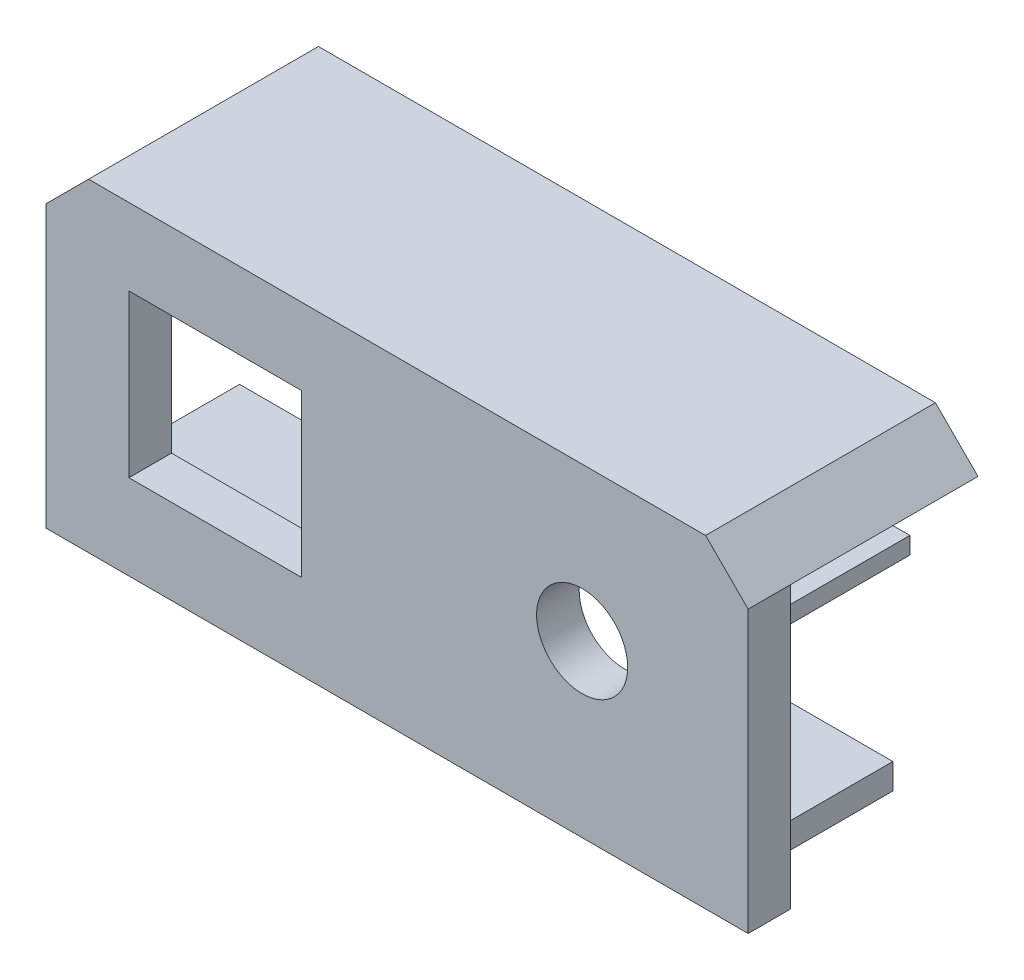
from build123d import *

# Parameters (mm, degrees)
SKETCH1_W           = 82.48
SKETCH1_H           = 33
BOSS_EXTRUDE1_DEPTH = 5
SKETCH2_W           = 82.48
SKETCH2_H           = 5
BOSS_EXTRUDE2_DEPTH = 5
CHAMFER1_SIZE       = 5
CUT_EXTRUDE1_REACH  = 92.95
SKETCH3_R           = 5.35
BOSS_EXTRUDE3_DEPTH = 22
SKETCH5_W           = 21.796115959
SKETCH5_H           = 3
SKETCH5_W_2         = 39.443884041
BOSS_EXTRUDE4_DEPTH = 15
SKETCH6_W           = 4
SKETCH6_H           = 23
BOSS_EXTRUDE5_DEPTH = 3
CUT_EXTRUDE2_REACH  = 95.44
SKETCH7_W           = 20.272158998
SKETCH7_H           = 19


with BuildPart() as part:
    # Sketch1 → Boss-Extrude1 (new body)
    with BuildSketch(Plane.XY):
        with Locations((41.24, 16.5)):
            Rectangle(SKETCH1_W, SKETCH1_H)
    extrude(amount=BOSS_EXTRUDE1_DEPTH)

    # Sketch2 → Boss-Extrude2 (add)
    with BuildSketch(Plane(origin=(0, 33, 0), x_dir=(1, 0, 0), z_dir=(0, 1, 0))):
        with Locations((41.24, -2.5)):
            Rectangle(SKETCH2_W, SKETCH2_H)
    extrude(amount=BOSS_EXTRUDE2_DEPTH)

    # Chamfer1
    chamfer1_edges = [part.edges().sort_by_distance(p)[0] for p in [
        (82.48, 38, 2.5),
        (0, 38, 2.5),
    ]]
    chamfer(chamfer1_edges, length=CHAMFER1_SIZE)

    # Sketch3 → Cut-Extrude1 (cut, up to next)
    with BuildSketch(Plane.XY.offset(5), mode=Mode.PRIVATE) as cut_extrude1_sk1:
        with Locations((62.98, 20)):
            Circle(SKETCH3_R)
    cut_extrude1_tool1 = extrude(cut_extrude1_sk1.sketch, amount=-CUT_EXTRUDE1_REACH, mode=Mode.PRIVATE) & part.part
    add(cut_extrude1_tool1.solids().sort_by_distance((62.98, 20, 5))[0], mode=Mode.SUBTRACT)

    # Sketch4 → Boss-Extrude3 (add)
    with BuildSketch(Plane(origin=(0, 0, 0), x_dir=(-1, 0, 0), z_dir=(0, 0, -1))):
        Polygon((-82.48, 33), (0, 33), (-5, 38), (-77.48, 38), align=None)
    extrude(amount=BOSS_EXTRUDE3_DEPTH)

    # Sketch5 → Boss-Extrude4 (add)
    with BuildSketch(Plane(origin=(0, 0, 0), x_dir=(-1, 0, 0), z_dir=(0, 0, -1))):
        Polygon((-79.48, 33), (-77.48, 33), (-77.48, 30), (-75.48, 30), (-75.48, 28), (-81.48, 28), (-81.48, 30), (-79.48, 30), align=None)
        Polygon((-6.74, 33), (-4.74, 33), (-4.74, 30), (-2.74, 30), (-2.74, 28), (-8.74, 28), (-8.74, 30), (-6.74, 30), align=None)
        with Locations((-68.581942021, 4.5)):
            Rectangle(SKETCH5_W, SKETCH5_H)
        with Locations((-22.461942021, 4.5)):
            Rectangle(SKETCH5_W_2, SKETCH5_H)
    extrude(amount=BOSS_EXTRUDE4_DEPTH)

    # Sketch6 → Boss-Extrude5 (add)
    with BuildSketch(Plane(origin=(0, 0, 0), x_dir=(-1, 0, 0), z_dir=(0, 0, -1))):
        with Locations((-49.262158998, 21.5)):
            Rectangle(SKETCH6_W, SKETCH6_H)
        with Locations((-38.262158998, 21.5)):
            Rectangle(SKETCH6_W, SKETCH6_H)
    extrude(amount=BOSS_EXTRUDE5_DEPTH)

    # Sketch7 → Cut-Extrude2 (cut, up to next)
    with BuildSketch(Plane(origin=(0, 0, 0), x_dir=(-1, 0, 0), z_dir=(0, 0, -1)), mode=Mode.PRIVATE) as cut_extrude2_sk1:
        with Locations((-19.876079499, 19.5)):
            Rectangle(SKETCH7_W, SKETCH7_H)
    cut_extrude2_tool1 = extrude(cut_extrude2_sk1.sketch, amount=-CUT_EXTRUDE2_REACH, mode=Mode.PRIVATE) & part.part
    add(cut_extrude2_tool1.solids().sort_by_distance((19.876079, 19.5, 0))[0], mode=Mode.SUBTRACT)


solid = part.part
